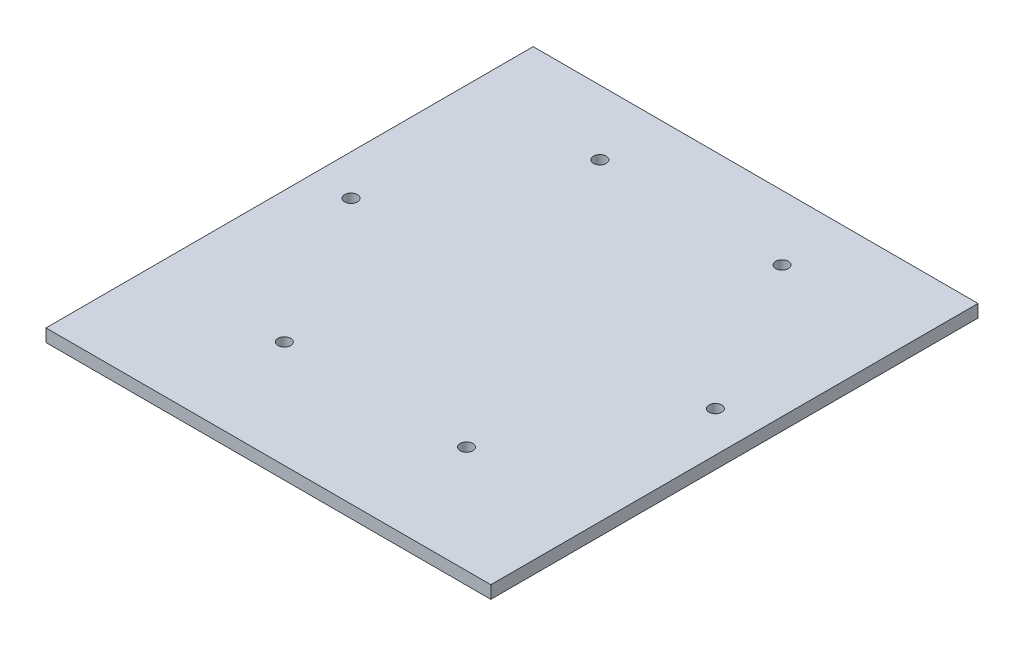
from build123d import *

# Parameters (mm, degrees)
SKETCH1_W           = 210
SKETCH1_H           = 230
SKETCH1_R           = 3
BOSS_EXTRUDE1_DEPTH = 6


with BuildPart() as part:
    # Sketch1 → Boss-Extrude1 (new body)
    with BuildSketch(Plane(origin=(0, 0, 0), x_dir=(1, 0, 0), z_dir=(0, 1, 0))):
        with Locations((105, 115)):
            Rectangle(SKETCH1_W, SKETCH1_H)
        with Locations(Location((62, 199.478184725, 0), (0, 0, 270))):
            Circle(SKETCH1_R, mode=Mode.SUBTRACT)
        with Locations(Location((148, 199.478184725, 0), (0, 0, 270))):
            Circle(SKETCH1_R, mode=Mode.SUBTRACT)
        with Locations(Location((191, 125, 0), (0, 0, 270))):
            Circle(SKETCH1_R, mode=Mode.SUBTRACT)
        with Locations(Location((148, 50.521815275, 0), (0, 0, 270))):
            Circle(SKETCH1_R, mode=Mode.SUBTRACT)
        with Locations(Location((62, 50.521815275, 0), (0, 0, 270))):
            Circle(SKETCH1_R, mode=Mode.SUBTRACT)
        with Locations(Location((19, 125, 0), (0, 0, 270))):
            Circle(SKETCH1_R, mode=Mode.SUBTRACT)
    extrude(amount=BOSS_EXTRUDE1_DEPTH)


solid = part.part
